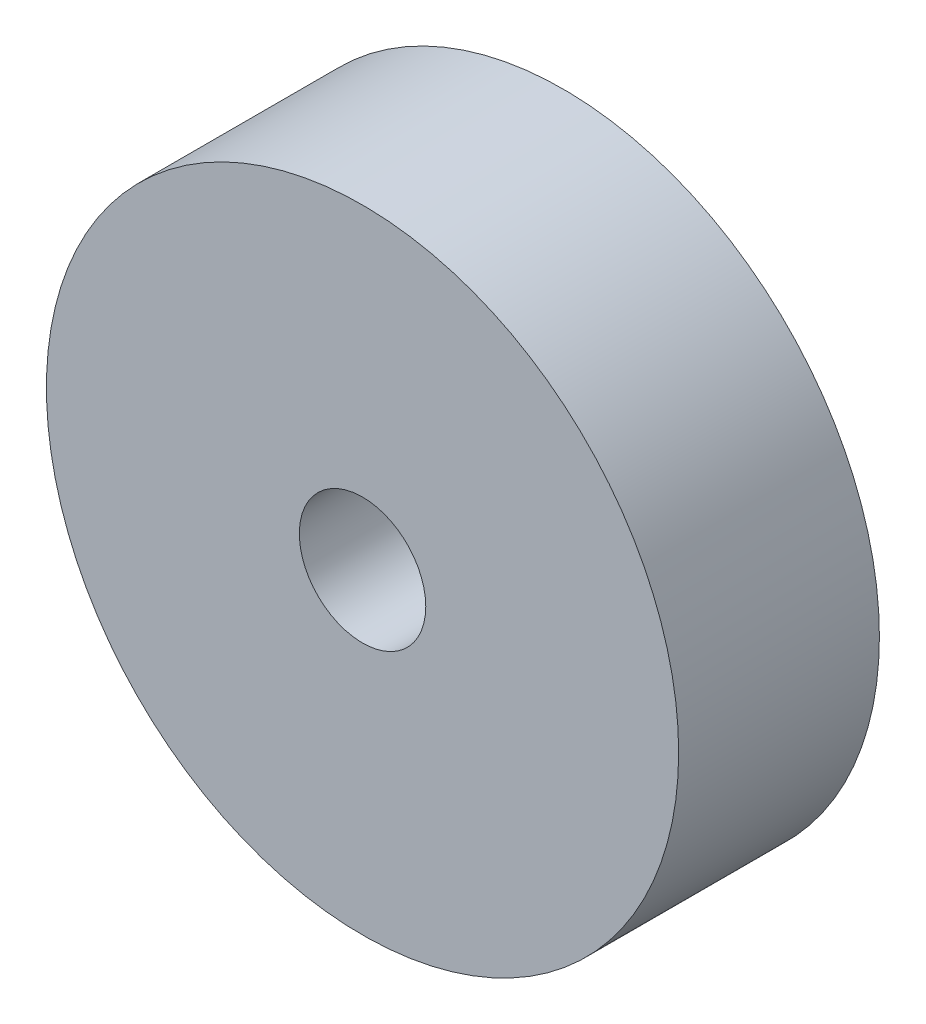
from build123d import *

# Parameters (mm, degrees)
SKETCH1_R           = 10
SKETCH1_R_2         = 2
BOSS_EXTRUDE1_DEPTH = 6.35


with BuildPart() as part:
    # Sketch1 → Boss-Extrude1 (new body)
    with BuildSketch(Plane.XY):
        Circle(SKETCH1_R)
        Circle(SKETCH1_R_2, mode=Mode.SUBTRACT)
    extrude(amount=BOSS_EXTRUDE1_DEPTH)


solid = part.part
